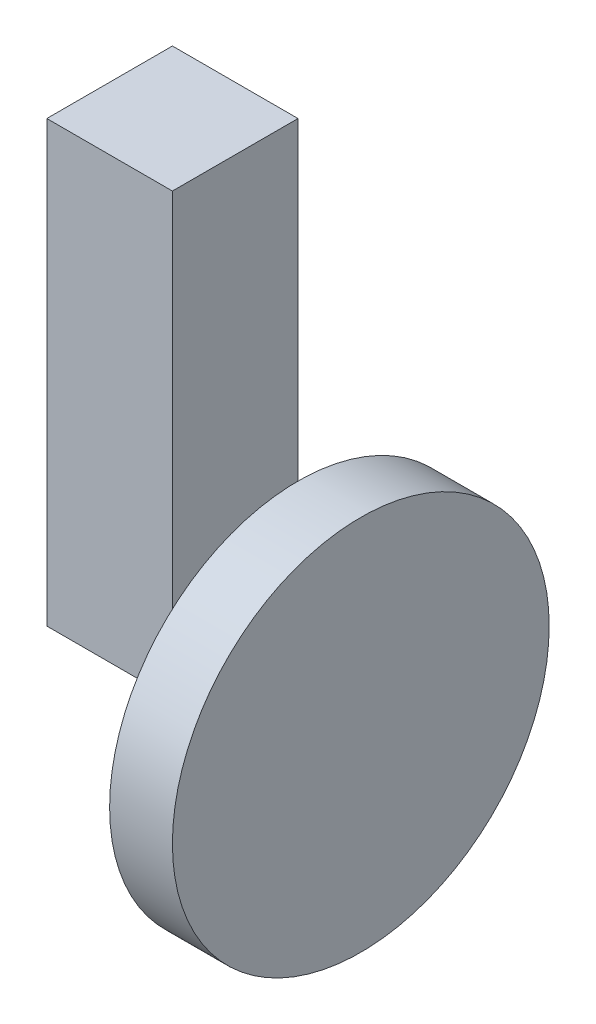
from build123d import *

# Parameters (mm, degrees)
SKETCH_1_W      = 20
SKETCH_1_H      = 20
EXTRUDE_1_DEPTH = 70
SKETCH_2_W      = 20
SKETCH_2_H      = 20
EXTRUDE_2_DEPTH = 10
SKETCH_4_R      = 30
SKETCH_4_R_2    = 25
EXTRUDE_5_DEPTH = 10
SKETCH_6_R      = 25
EXTRUDE_6_DEPTH = 10


with BuildPart() as part:
    # 草图1 → 凸台-拉伸1 (new body)
    with BuildSketch(Plane(origin=(0, 0, 0), x_dir=(1, 0, 0), z_dir=(0, 1, 0))):
        Rectangle(SKETCH_1_W, SKETCH_1_H)
    extrude(amount=-EXTRUDE_1_DEPTH)

    # 草图2 → 凸台-拉伸2 (add)
    with BuildSketch(Plane(origin=(10, 0, 0), x_dir=(0, 0, -1), z_dir=(1, 0, 0))):
        with Locations((0, -70)):
            Rectangle(SKETCH_2_W, SKETCH_2_H)
    extrude(amount=EXTRUDE_2_DEPTH)



with BuildPart() as body_2:
    # 草图4 → 凸台-拉伸5 (new body)
    with BuildSketch(Plane(origin=(20, 0, 0), x_dir=(0, 0, -1), z_dir=(1, 0, 0))):
        with Locations((0, -70)):
            Circle(SKETCH_4_R)
        with Locations((0, -70)):
            Circle(SKETCH_4_R_2, mode=Mode.SUBTRACT)
    extrude(amount=EXTRUDE_5_DEPTH)


with BuildPart() as part_1:
    add(part.part)

    add(body_2.part)  # 凸台-拉伸6 merges body 2
    # 草图6 → 凸台-拉伸6 (add)
    with BuildSketch(Plane(origin=(20, 0, 0), x_dir=(0, 0, -1), z_dir=(1, 0, 0))):
        with Locations((0, -70)):
            Circle(SKETCH_6_R)
    extrude(amount=EXTRUDE_6_DEPTH)


solid = part_1.part
